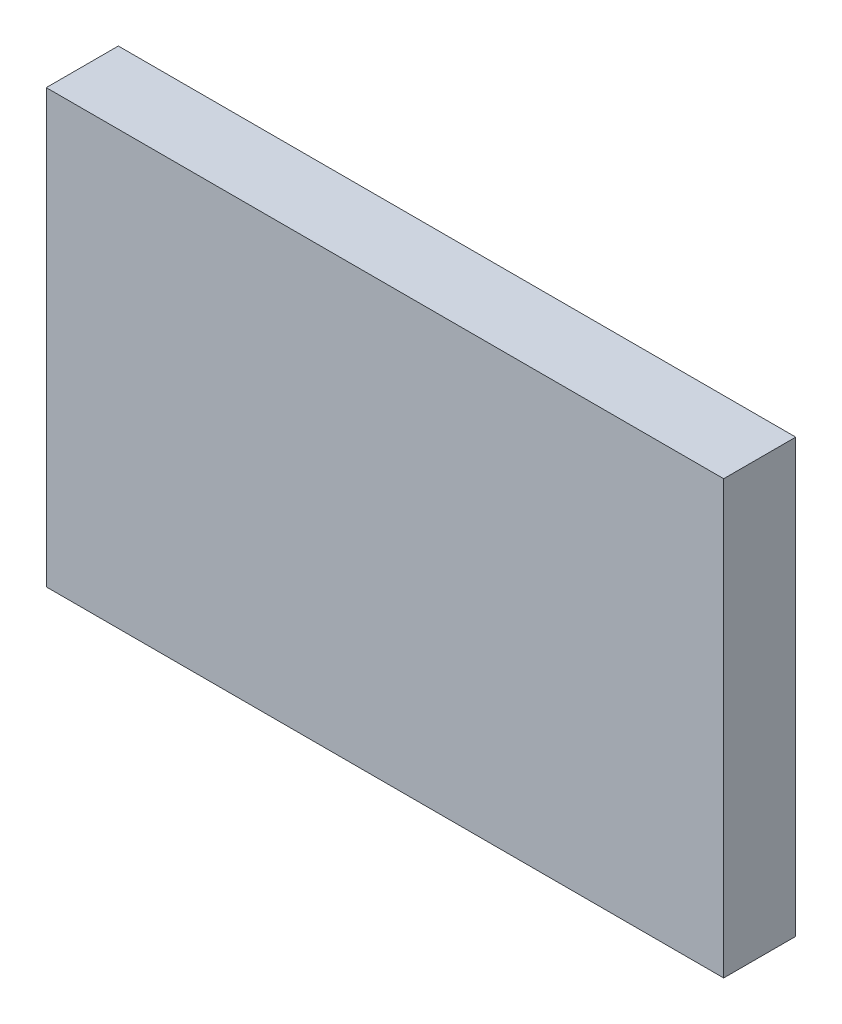
from build123d import *

# Parameters (mm, degrees)
SKETCH_1_W      = 94
SKETCH_1_H      = 60
EXTRUDE_1_DEPTH = 10


with BuildPart() as part:
    # 草图1 → 凸台-拉伸1 (new body)
    with BuildSketch(Plane.XY):
        Rectangle(SKETCH_1_W, SKETCH_1_H)
    extrude(amount=EXTRUDE_1_DEPTH)


solid = part.part
